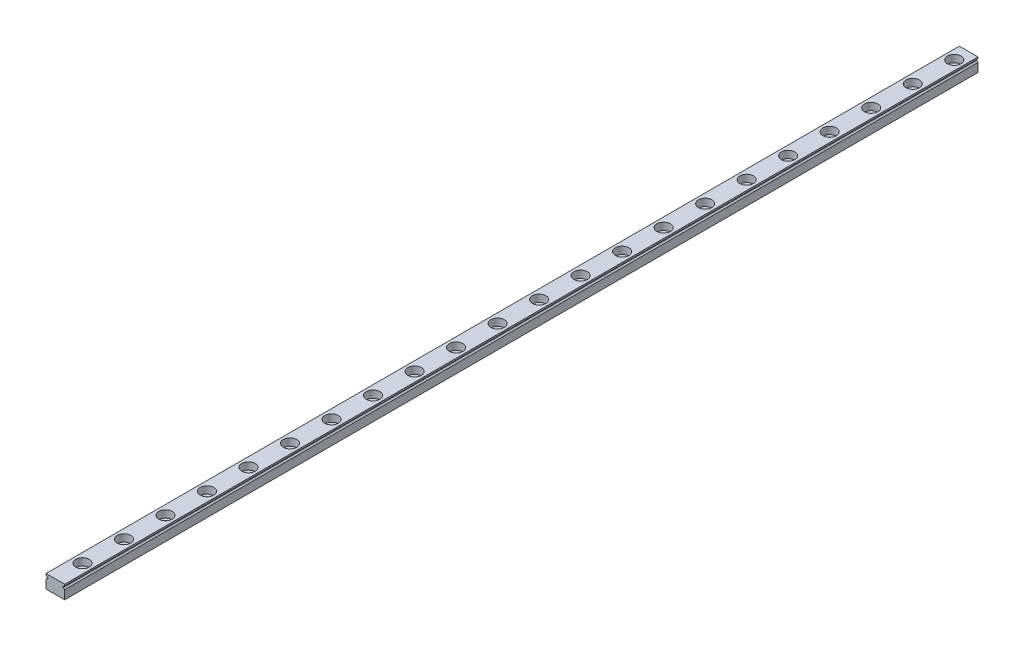
from build123d import *

# Parameters (mm, degrees)
EXTRUDE_1_DEPTH     = 440
SKETCH_2_R          = 1.75
CUT_EXTRUDE_3_DEPTH = 440
SKETCH_3_R          = 3.25
CUT_EXTRUDE_4_DEPTH = 3.5


with BuildPart() as part:
    # 草图1 → 凸台-拉伸1 (new body)
    with BuildSketch(Plane.XY):
        Polygon((0, 0), (-9, 0), (-9, 4.208125846), (-8.343397225, 4.785997189), (-8.055092033, 4.785997189), (-8.055092033, 5.184529149), (-8.343397225, 5.184529149), (-9, 5.762400492), (-9, 6.5), (0, 6.5), (0, 5.762400492), (-0.656602775, 5.184529149), (-0.944907967, 5.184529149), (-0.944907967, 4.785997189), (-0.656602775, 4.785997189), (0, 4.208125846), align=None)
    extrude(amount=EXTRUDE_1_DEPTH)

    # 草图2 → 切除-拉伸3 (cut)
    with BuildSketch(Plane(origin=(0, 6.5, 0), x_dir=(1, 0, 0), z_dir=(0, 1, 0))):
        with Locations(Location((-4.5, -6.942433545, 0), (0, 0, 180))):
            Circle(SKETCH_2_R)
        with Locations(Location((-4.5, -26.942433545, 0), (0, 0, 180))):
            Circle(SKETCH_2_R)
        with Locations(Location((-4.5, -46.942433545, 0), (0, 0, 180))):
            Circle(SKETCH_2_R)
        with Locations(Location((-4.5, -66.942433545, 0), (0, 0, 180))):
            Circle(SKETCH_2_R)
        with Locations(Location((-4.5, -86.942433545, 0), (0, 0, 180))):
            Circle(SKETCH_2_R)
        with Locations(Location((-4.5, -106.942433545, 0), (0, 0, 180))):
            Circle(SKETCH_2_R)
        with Locations(Location((-4.5, -126.942433545, 0), (0, 0, 180))):
            Circle(SKETCH_2_R)
        with Locations(Location((-4.5, -146.942433545, 0), (0, 0, 180))):
            Circle(SKETCH_2_R)
        with Locations(Location((-4.5, -166.942433545, 0), (0, 0, 180))):
            Circle(SKETCH_2_R)
        with Locations(Location((-4.5, -186.942433545, 0), (0, 0, 180))):
            Circle(SKETCH_2_R)
        with Locations(Location((-4.5, -206.942433545, 0), (0, 0, 180))):
            Circle(SKETCH_2_R)
        with Locations(Location((-4.5, -226.942433545, 0), (0, 0, 180))):
            Circle(SKETCH_2_R)
        with Locations(Location((-4.5, -246.942433545, 0), (0, 0, 180))):
            Circle(SKETCH_2_R)
        with Locations(Location((-4.5, -266.942433545, 0), (0, 0, 180))):
            Circle(SKETCH_2_R)
        with Locations(Location((-4.5, -286.942433545, 0), (0, 0, 180))):
            Circle(SKETCH_2_R)
        with Locations(Location((-4.5, -306.942433545, 0), (0, 0, 180))):
            Circle(SKETCH_2_R)
        with Locations(Location((-4.5, -326.942433545, 0), (0, 0, 180))):
            Circle(SKETCH_2_R)
        with Locations(Location((-4.5, -346.942433545, 0), (0, 0, 180))):
            Circle(SKETCH_2_R)
        with Locations(Location((-4.5, -366.942433545, 0), (0, 0, 180))):
            Circle(SKETCH_2_R)
        with Locations(Location((-4.5, -386.942433545, 0), (0, 0, 180))):
            Circle(SKETCH_2_R)
        with Locations(Location((-4.5, -406.942433545, 0), (0, 0, 180))):
            Circle(SKETCH_2_R)
        with Locations(Location((-4.5, -426.942433545, 0), (0, 0, 180))):
            Circle(SKETCH_2_R)
    extrude(amount=-CUT_EXTRUDE_3_DEPTH, mode=Mode.SUBTRACT)

    # 草图3 → 切除-拉伸4 (cut)
    with BuildSketch(Plane(origin=(0, 6.5, 0), x_dir=(1, 0, 0), z_dir=(0, 1, 0))):
        with Locations(Location((-4.5, -6.942433545, 0), (0, 0, 180))):
            Circle(SKETCH_3_R)
        with Locations(Location((-4.5, -26.942433545, 0), (0, 0, 180))):
            Circle(SKETCH_3_R)
        with Locations(Location((-4.5, -46.942433545, 0), (0, 0, 180))):
            Circle(SKETCH_3_R)
        with Locations(Location((-4.5, -66.942433545, 0), (0, 0, 180))):
            Circle(SKETCH_3_R)
        with Locations(Location((-4.5, -86.942433545, 0), (0, 0, 180))):
            Circle(SKETCH_3_R)
        with Locations(Location((-4.5, -106.942433545, 0), (0, 0, 180))):
            Circle(SKETCH_3_R)
        with Locations(Location((-4.5, -126.942433545, 0), (0, 0, 180))):
            Circle(SKETCH_3_R)
        with Locations(Location((-4.5, -146.942433545, 0), (0, 0, 180))):
            Circle(SKETCH_3_R)
        with Locations(Location((-4.5, -166.942433545, 0), (0, 0, 180))):
            Circle(SKETCH_3_R)
        with Locations(Location((-4.5, -186.942433545, 0), (0, 0, 180))):
            Circle(SKETCH_3_R)
        with Locations(Location((-4.5, -206.942433545, 0), (0, 0, 180))):
            Circle(SKETCH_3_R)
        with Locations(Location((-4.5, -226.942433545, 0), (0, 0, 180))):
            Circle(SKETCH_3_R)
        with Locations(Location((-4.5, -246.942433545, 0), (0, 0, 180))):
            Circle(SKETCH_3_R)
        with Locations(Location((-4.5, -266.942433545, 0), (0, 0, 180))):
            Circle(SKETCH_3_R)
        with Locations(Location((-4.5, -286.942433545, 0), (0, 0, 180))):
            Circle(SKETCH_3_R)
        with Locations(Location((-4.5, -306.942433545, 0), (0, 0, 180))):
            Circle(SKETCH_3_R)
        with Locations(Location((-4.5, -326.942433545, 0), (0, 0, 180))):
            Circle(SKETCH_3_R)
        with Locations(Location((-4.5, -346.942433545, 0), (0, 0, 180))):
            Circle(SKETCH_3_R)
        with Locations(Location((-4.5, -366.942433545, 0), (0, 0, 180))):
            Circle(SKETCH_3_R)
        with Locations(Location((-4.5, -386.942433545, 0), (0, 0, 180))):
            Circle(SKETCH_3_R)
        with Locations(Location((-4.5, -406.942433545, 0), (0, 0, 180))):
            Circle(SKETCH_3_R)
        with Locations(Location((-4.5, -426.942433545, 0), (0, 0, 180))):
            Circle(SKETCH_3_R)
        with Locations((-4.5, -446.942433545)):
            Circle(SKETCH_3_R)
        with Locations((-4.5, -466.942433545)):
            Circle(SKETCH_3_R)
        with Locations((-4.5, -486.942433545)):
            Circle(SKETCH_3_R)
        with Locations((-4.5, -506.942433545)):
            Circle(SKETCH_3_R)
        with Locations((-4.5, -526.942433545)):
            Circle(SKETCH_3_R)
        with Locations((-4.5, -546.942433545)):
            Circle(SKETCH_3_R)
        with Locations((-4.5, -566.942433545)):
            Circle(SKETCH_3_R)
        with Locations((-4.5, -586.942433545)):
            Circle(SKETCH_3_R)
        with Locations((-4.5, -606.942433545)):
            Circle(SKETCH_3_R)
    extrude(amount=-CUT_EXTRUDE_4_DEPTH, mode=Mode.SUBTRACT)


solid = part.part
